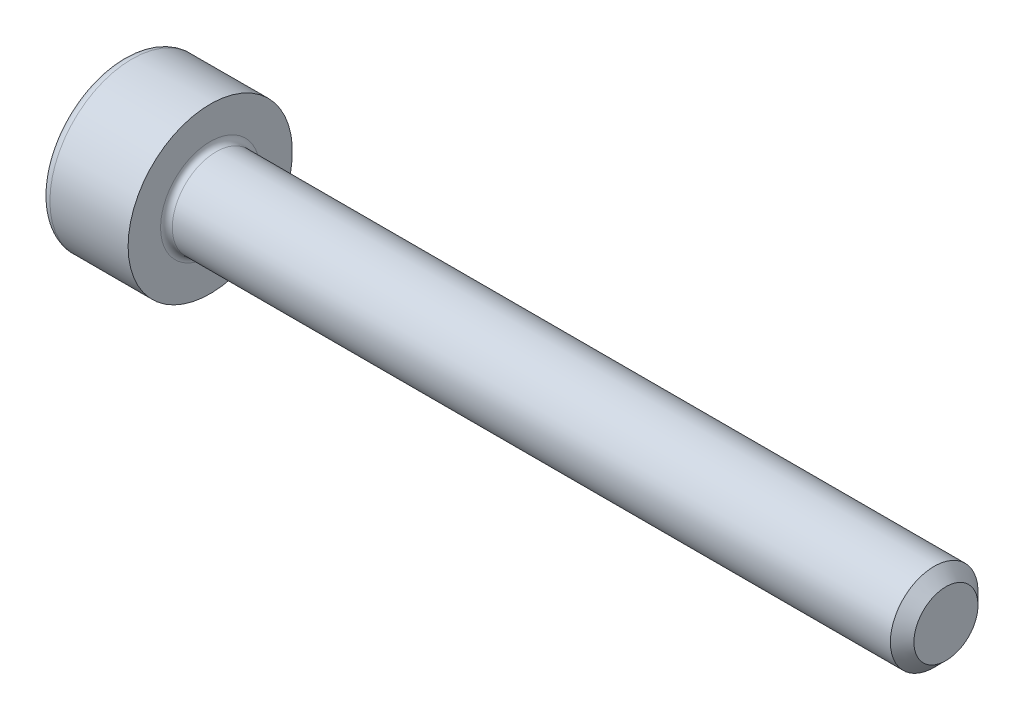
from build123d import *

# Parameters (mm, degrees)
FILLET1_R      = 0.1
FILLET2_R      = 0.16
CHAMFER1_SIZE  = 0.2
EXTRUDE1_DEPTH = 0.7


with BuildPart() as part:
    # Sketch1 → Revolve1 (revolve)
    with BuildSketch(Plane.XY, mode=Mode.PRIVATE) as revolve1_sk:
        Polygon((0, 1.395688245), (0, 0), (13.988734128, 0), (13.988734128, 0.744367064), (1.488734128, 0.744367064), (1.488734128, 1.395688245), align=None)
    revolve(revolve1_sk.sketch.rotate(Axis((0, 0, 0), (1, 0, 0)), 90), axis=Axis((0, 0, 0), (1, 0, 0)))

    # Fillet1
    fillet1_edges = [part.edges().sort_by_distance(p)[0] for p in [
        (1.488734128, 0, -0.744367064),
    ]]
    fillet(fillet1_edges, radius=FILLET1_R)

    # Fillet2
    fillet2_edges = [part.edges().sort_by_distance(p)[0] for p in [
        (0, 0, -1.395688245),
    ]]
    fillet(fillet2_edges, radius=FILLET2_R)

    # Chamfer1
    chamfer1_edges = [part.edges().sort_by_distance(p)[0] for p in [
        (13.988734128, 0, -0.744367064),
    ]]
    chamfer(chamfer1_edges, length=CHAMFER1_SIZE)

    # Sketch2 → Extrude1 (cut)
    with BuildSketch(Plane.ZY):
        Polygon((0, 0.877572409), (-0.76, 0.438786205), (-0.76, -0.438786205), (0, -0.877572409), (0.76, -0.438786205), (0.76, 0.438786205), align=None)
    extrude(amount=-EXTRUDE1_DEPTH, mode=Mode.SUBTRACT)


solid = part.part
